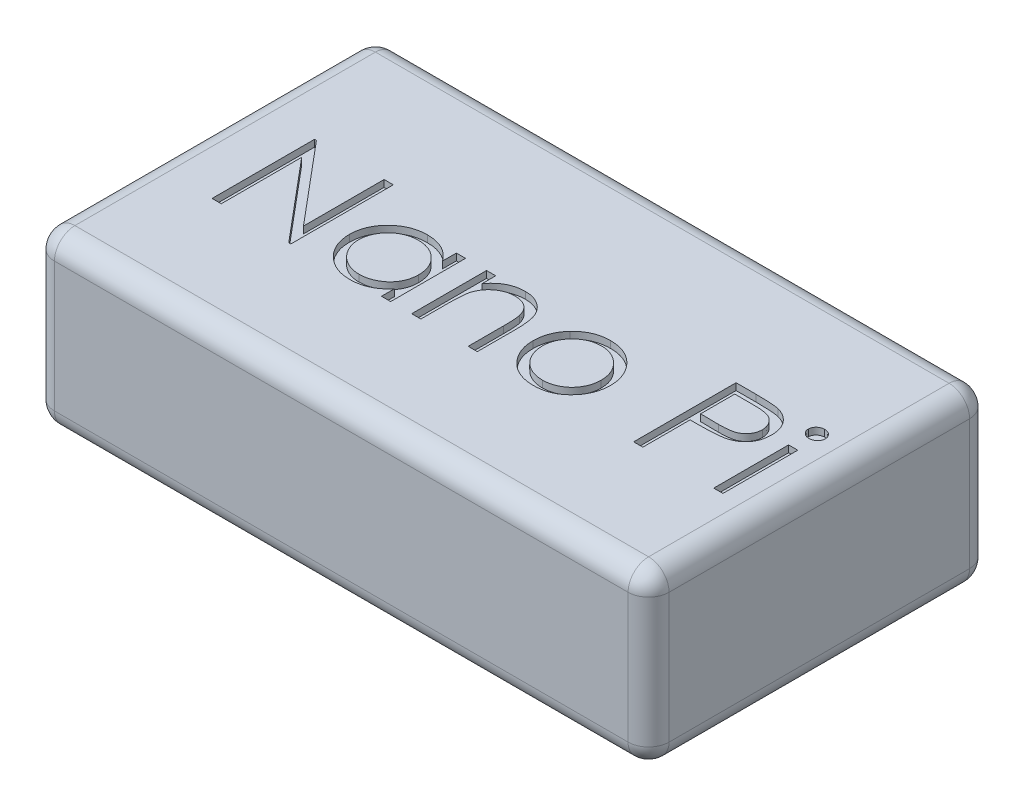
from build123d import *

# Parameters (mm, degrees)
SKETCH1_W           = 90
SKETCH1_H           = 50
BOSS_EXTRUDE1_DEPTH = 25
FILLET1_R           = 3
SKETCH2_W           = 1.346153846
SKETCH2_H           = 10.961538462
CUT_EXTRUDE1_DEPTH  = 1


with BuildPart() as part:
    # Sketch1 → Boss-Extrude1 (new body)
    with BuildSketch(Plane(origin=(0, 0, 0), x_dir=(1, 0, 0), z_dir=(0, 1, 0))):
        with Locations((-3.591549296, -0.528169014)):
            Rectangle(SKETCH1_W, SKETCH1_H)
    extrude(amount=BOSS_EXTRUDE1_DEPTH)

    # Fillet1
    fillet1_edges = [part.edges().sort_by_distance(p)[0] for p in [
        (41.408450704, 25, 0.528169014),
        (-3.591549296, 25, -24.471830986),
        (-48.591549296, 25, 0.528169014),
        (-3.591549296, 0, -24.471830986),
        (41.408450704, 0, 0.528169014),
        (-3.591549296, 0, 25.528169014),
        (-48.591549296, 0, 0.528169014),
        (-3.591549296, 25, 25.528169014),
        (-48.591549296, 12.5, -24.471830986),
        (41.408450704, 12.5, -24.471830986),
        (41.408450704, 12.5, 25.528169014),
        (-48.591549296, 12.5, 25.528169014),
    ]]
    fillet(fillet1_edges, radius=FILLET1_R)

    # Sketch2 → Cut-Extrude1 (cut)
    # profile 1 of 7: a face of its own
    with BuildSketch(Plane(origin=(0, 25, 0), x_dir=(1, 0, 0), z_dir=(0, 1, 0))):
        Polygon((-38.992409877, -9.047322297), (-38.992409877, 5.952677703), (-38.709957954, 5.952677703), (-28.800102185, -5.85321172), (-28.800102185, 5.952677703), (-27.453948339, 5.952677703), (-27.453948339, -9.047322297), (-27.760438724, -9.047322297), (-37.646256031, 2.731523857), (-37.646256031, -9.047322297), align=None)
    # profile 2 of 7: a face of its own
    with BuildSketch(Plane(origin=(0, 25, 0), x_dir=(1, 0, 0), z_dir=(0, 1, 0))):
        with BuildLine():
            Line((-12.838563724, 1.914216165), (-12.838563724, -9.047322297))
            Line((-12.838563724, -9.047322297), (-14.18471757, -9.047322297))
            Line((-14.18471757, -9.047322297), (-14.18471757, -7.151288643))
            add(Edge.make_bspline(
                [(-14.18471757, -7.151288643), (-14.336512387, -7.322886903), (-14.632741881, -7.657763064), (-15.127489529, -8.095258089), (-15.651924577, -8.456879467), (-16.203501668, -8.748950535), (-16.781722711, -8.968345062), (-17.385305942, -9.124285744), (-18.014497574, -9.224545037), (-18.444150523, -9.23455656), (-18.661881031, -9.239629989)],
                knots=[0, 0, 0, 0, 1.074387032, 2.096679803, 3.090159297, 4.057316773, 5.018401886, 5.985159533, 6.978961417, 8, 8, 8, 8], degree=3))
            add(Edge.make_bspline(
                [(-18.661881031, -9.239629989), (-18.855457976, -9.234374108), (-19.237200283, -9.224009277), (-19.798753471, -9.143599405), (-20.339148826, -9.014468169), (-20.858896994, -8.834892928), (-21.35463476, -8.596689407), (-21.830606603, -8.31151263), (-22.284346712, -7.971909072), (-22.708939022, -7.583674665), (-23.099933309, -7.161981863), (-23.443053049, -6.712215233), (-23.729137677, -6.236319645), (-23.968366594, -5.740320414), (-24.152636642, -5.220399331), (-24.281095074, -4.678354325), (-24.361411274, -4.114826296), (-24.37177182, -3.731085482), (-24.377025262, -3.536504989)],
                knots=[0, 0, 0, 0, 1.033919861, 2.038935746, 3.024066025, 3.998881131, 4.97069526, 5.957263378, 6.95902576, 7.993208707, 9.027059324, 10.027763471, 11.009749337, 11.988697705, 12.965288445, 13.950418724, 14.960734635, 16, 16, 16, 16], degree=3))
            add(Edge.make_bspline(
                [(-24.377025262, -3.536504989), (-24.371655385, -3.345946259), (-24.361039427, -2.969221931), (-24.281954199, -2.415170368), (-24.148964162, -1.881520679), (-23.962330529, -1.369990922), (-23.723007865, -0.879962136), (-23.431887492, -0.411087743), (-23.088948386, 0.03792396), (-22.693580927, 0.456514932), (-22.265289055, 0.843174708), (-21.80710878, 1.179213474), (-21.330437574, 1.46942854), (-20.827881815, 1.69937201), (-20.306879937, 1.88541103), (-19.762793741, 2.01412375), (-19.197886975, 2.089969412), (-18.814356295, 2.100952687), (-18.619813724, 2.106523857)],
                knots=[0, 0, 0, 0, 1.020392517, 2.01726096, 2.990465484, 3.961182959, 4.928053699, 5.906110375, 6.912531644, 7.948652711, 8.985773172, 9.998621852, 10.987621588, 11.969261332, 12.953316658, 13.946091881, 14.958173133, 16, 16, 16, 16], degree=3))
            add(Edge.make_bspline(
                [(-18.619813724, 2.106523857), (-18.396100042, 2.100362065), (-17.957408071, 2.088279081), (-17.315716602, 1.987724535), (-16.70866884, 1.81784539), (-16.13157876, 1.586770399), (-15.586518676, 1.279704417), (-15.078648744, 0.892361727), (-14.602653815, 0.427185211), (-14.32673828, 0.069883307), (-14.18471757, -0.114029027)],
                knots=[0, 0, 0, 0, 1.038897134, 2.037228247, 3.008116434, 3.962042015, 4.918381754, 5.904844433, 6.921570401, 8, 8, 8, 8], degree=3))
            Line((-14.18471757, -0.114029027), (-14.18471757, 1.914216165))
            Line((-14.18471757, 1.914216165), (-12.838563724, 1.914216165))
        make_face()
        with BuildLine():
            add(Edge.make_bspline(
                [(-18.601784877, 0.760370011), (-18.798560611, 0.753368707), (-19.186964611, 0.739549245), (-19.757153191, 0.631662837), (-20.302782109, 0.452157433), (-20.821122427, 0.20666357), (-21.303986213, -0.102031015), (-21.735530516, -0.475408372), (-22.119284951, -0.90328129), (-22.442034654, -1.383718906), (-22.705136784, -1.898767868), (-22.89013835, -2.437158317), (-23.01214941, -2.989179649), (-23.024614498, -3.363591159), (-23.030871416, -3.551529027)],
                knots=[0, 0, 0, 0, 1.031046209, 2.035121221, 3.029706178, 4.034933723, 5.034054252, 6.02443088, 7.017295772, 8.038157696, 9.050218397, 10.03989886, 11.016116709, 12, 12, 12, 12], degree=3))
            add(Edge.make_bspline(
                [(-23.030871416, -3.551529027), (-23.022879016, -3.738343772), (-23.006925544, -4.111241012), (-22.892279711, -4.664014912), (-22.699937396, -5.202532235), (-22.437471413, -5.722222208), (-22.10881445, -6.204725495), (-21.727863082, -6.640754592), (-21.290933305, -7.01570997), (-20.806958274, -7.329585285), (-20.290066972, -7.583138946), (-19.74649298, -7.759563116), (-19.186454531, -7.87346789), (-18.805658815, -7.886772791), (-18.613804108, -7.893476143)],
                knots=[0, 0, 0, 0, 0.979072187, 1.954306742, 2.945804271, 3.96968567, 4.997920485, 5.998718438, 6.996577872, 8.005894225, 9.015743152, 10.005417472, 10.995077863, 12, 12, 12, 12], degree=3))
            add(Edge.make_bspline(
                [(-18.613804108, -7.893476143), (-18.419033382, -7.886362012), (-18.031653726, -7.87221271), (-17.459773549, -7.763864431), (-16.904795137, -7.584855295), (-16.374278444, -7.33671618), (-15.880066453, -7.029184655), (-15.436504121, -6.669154265), (-15.061435685, -6.250426333), (-14.743467358, -5.790241534), (-14.494144144, -5.285761549), (-14.312532461, -4.748615018), (-14.205158579, -4.17878324), (-14.191625452, -3.78936641), (-14.18471757, -3.590591527)],
                knots=[0, 0, 0, 0, 1.01762866, 2.023962475, 3.030623092, 4.058876274, 5.077231937, 6.066672613, 7.034107872, 8.005628644, 8.981990164, 9.965428785, 10.961468474, 12, 12, 12, 12], degree=3))
            add(Edge.make_bspline(
                [(-14.18471757, -3.590591527), (-14.188830383, -3.439143682), (-14.1969257, -3.141046397), (-14.258770998, -2.703357036), (-14.357149254, -2.28449821), (-14.495775697, -1.884029542), (-14.677881202, -1.504165191), (-14.897514484, -1.142177647), (-15.15853784, -0.799949598), (-15.456749395, -0.48219358), (-15.783171692, -0.192365884), (-16.128576866, 0.066338005), (-16.49705721, 0.278861316), (-16.88241594, 0.45475248), (-17.285321659, 0.594720265), (-17.709052886, 0.688096096), (-18.149105688, 0.752211757), (-18.449303068, 0.75762196), (-18.601784877, 0.760370011)],
                knots=[0, 0, 0, 0, 1.050140795, 2.067009409, 3.05949893, 4.030605086, 5.00011959, 5.97591094, 6.962425594, 7.979863591, 8.993523472, 9.986985069, 10.967611495, 11.937549037, 12.921786183, 13.919465291, 14.943216303, 16, 16, 16, 16], degree=3))
        make_face(mode=Mode.SUBTRACT)
    # profile 3 of 7: a face of its own
    with BuildSketch(Plane(origin=(0, 25, 0), x_dir=(1, 0, 0), z_dir=(0, 1, 0))):
        with BuildLine():
            Line((-9.761640647, 1.914216165), (-8.415486801, 1.914216165))
            Line((-8.415486801, 1.914216165), (-8.415486801, -0.062947297))
            add(Edge.make_bspline(
                [(-8.415486801, -0.062947297), (-8.271754079, 0.116378658), (-7.992835717, 0.464366931), (-7.528331431, 0.921740821), (-7.037429001, 1.298648929), (-6.523134701, 1.59909376), (-5.984750372, 1.825579301), (-5.425557786, 1.989147577), (-4.842209046, 2.087225413), (-4.445504316, 2.100040686), (-4.244813724, 2.106523857)],
                knots=[0, 0, 0, 0, 1.12780773, 2.188550248, 3.19190651, 4.159438251, 5.104880172, 6.052711206, 7.014878035, 8, 8, 8, 8], degree=3))
            add(Edge.make_bspline(
                [(-4.244813724, 2.106523857), (-4.041968149, 2.099044448), (-3.64495043, 2.084405441), (-3.066901595, 1.968619622), (-2.527015622, 1.770854242), (-2.027217526, 1.499945369), (-1.576672326, 1.163060483), (-1.180994391, 0.770584276), (-0.853723331, 0.319143919), (-0.634306061, -0.099669608), (-0.489767571, -0.471193012), (-0.398771839, -0.789393369), (-0.321496204, -1.143899731), (-0.254502998, -1.533640827), (-0.209172519, -1.961347357), (-0.173419841, -2.425266037), (-0.147796865, -2.925246597), (-0.146780264, -3.271046428), (-0.146256031, -3.449365566)],
                knots=[0, 0, 0, 0, 1.235846778, 2.418850247, 3.575807741, 4.728682307, 5.871620074, 6.994088408, 8.11269785, 9.256955736, 9.865816715, 10.540099792, 11.271859618, 12.076849838, 12.949306005, 13.892391288, 14.913166135, 16, 16, 16, 16], degree=3))
            Line((-0.146256031, -3.449365566), (-0.146256031, -9.047322297))
            Line((-0.146256031, -9.047322297), (-1.492409877, -9.047322297))
            Line((-1.492409877, -9.047322297), (-1.492409877, -3.891072297))
            add(Edge.make_bspline(
                [(-1.492409877, -3.891072297), (-1.493237912, -3.741833247), (-1.494821801, -3.456364344), (-1.499817429, -3.047639958), (-1.511859458, -2.676983194), (-1.528780799, -2.345280191), (-1.553548072, -2.052849463), (-1.57935935, -1.799095419), (-1.610923536, -1.584340238), (-1.639050306, -1.455061313), (-1.651664685, -1.397081912)],
                knots=[0, 0, 0, 0, 1.430800155, 2.736877192, 3.918605307, 4.986035426, 5.920637409, 6.731861385, 7.431261377, 8, 8, 8, 8], degree=3))
            add(Edge.make_bspline(
                [(-1.651664685, -1.397081912), (-1.697202677, -1.226891119), (-1.784849223, -0.8993265), (-2.001423436, -0.455007845), (-2.274912783, -0.077015612), (-2.608760709, 0.232313195), (-2.999742461, 0.473045352), (-3.446773073, 0.640076587), (-3.945538676, 0.744546312), (-4.296343173, 0.754948306), (-4.479188724, 0.760370011)],
                knots=[0, 0, 0, 0, 1.084156227, 2.086665306, 3.027808233, 3.945421172, 4.874247719, 5.839848303, 6.874090471, 8, 8, 8, 8], degree=3))
            add(Edge.make_bspline(
                [(-4.479188724, 0.760370011), (-4.587478796, 0.758329991), (-4.801782052, 0.754292844), (-5.119567646, 0.713787281), (-5.427814102, 0.647536757), (-5.729614998, 0.558099739), (-6.018934114, 0.435261443), (-6.30506679, 0.295849856), (-6.577238637, 0.122071805), (-6.841253196, -0.071602287), (-7.086879514, -0.286227461), (-7.315429536, -0.512703933), (-7.519163909, -0.753885092), (-7.703743946, -1.005884867), (-7.86307936, -1.272164173), (-8.002164023, -1.550154058), (-8.120174144, -1.84022041), (-8.178814254, -2.041542101), (-8.20815507, -2.14227422)],
                knots=[0, 0, 0, 0, 1.023777757, 2.026029729, 3.023749952, 4.003683103, 4.997618607, 5.993177895, 7.010360494, 8.046726602, 9.087585522, 10.09234134, 11.086953743, 12.070360549, 13.043493632, 14.017870808, 15.008233677, 16, 16, 16, 16], degree=3))
            add(Edge.make_bspline(
                [(-8.20815507, -2.14227422), (-8.225039278, -2.21622509), (-8.261795316, -2.377212266), (-8.301494658, -2.641402635), (-8.337527124, -2.947016813), (-8.367685518, -3.293698172), (-8.386137303, -3.682660494), (-8.406256146, -4.112242656), (-8.413580694, -4.584157606), (-8.41483364, -4.912707718), (-8.415486801, -5.08398095)],
                knots=[0, 0, 0, 0, 0.615963638, 1.340920617, 2.168419149, 3.115676021, 4.16674242, 5.331190069, 6.6087489, 8, 8, 8, 8], degree=3))
            Line((-8.415486801, -5.08398095), (-8.415486801, -9.047322297))
            Line((-8.415486801, -9.047322297), (-9.761640647, -9.047322297))
            Line((-9.761640647, -9.047322297), (-9.761640647, 1.914216165))
        make_face()
    # profile 4 of 7: a face of its own
    with BuildSketch(Plane(origin=(0, 25, 0), x_dir=(1, 0, 0), z_dir=(0, 1, 0))):
        with BuildLine():
            add(Edge.make_bspline(
                [(8.225138199, 2.106523857), (8.430815083, 2.102144324), (8.834097187, 2.093557129), (9.424702412, 2.001778705), (9.98846728, 1.861432857), (10.527550961, 1.667411877), (11.03504937, 1.407346375), (11.518354702, 1.097020841), (11.976141883, 0.729381155), (12.250526294, 0.444989433), (12.389801661, 0.300634434)],
                knots=[0, 0, 0, 0, 1.054011418, 2.066658804, 3.057071809, 4.030435133, 4.997543892, 5.974964718, 6.972108034, 8, 8, 8, 8], degree=3))
            add(Edge.make_bspline(
                [(12.389801661, 0.300634434), (12.509724321, 0.162574495), (12.747248808, -0.110873543), (13.051816174, -0.554254741), (13.314194289, -1.013426601), (13.524464122, -1.494486573), (13.690257081, -1.993235163), (13.807967207, -2.51138664), (13.877982643, -3.047796699), (13.88742393, -3.412098862), (13.892205507, -3.596601143)],
                knots=[0, 0, 0, 0, 1.025258237, 2.030674902, 3.01204498, 3.988269485, 4.97094183, 5.956517959, 6.965070386, 8, 8, 8, 8], degree=3))
            add(Edge.make_bspline(
                [(13.892205507, -3.596601143), (13.887999776, -3.782172819), (13.879689054, -4.148871104), (13.801073556, -4.6889541), (13.678797473, -5.212646198), (13.503803881, -5.717754885), (13.279411984, -6.205824145), (13.005594752, -6.674722214), (12.680430678, -7.125374214), (12.311842121, -7.55395352), (11.904476937, -7.948951584), (11.462550588, -8.293215596), (10.994747586, -8.588164986), (10.4948475, -8.825749625), (9.967415414, -9.013076912), (9.411313693, -9.144648411), (8.827406249, -9.224198484), (8.428718158, -9.234413798), (8.225138199, -9.239629989)],
                knots=[0, 0, 0, 0, 0.998656419, 1.973391657, 2.932242238, 3.890759089, 4.846373663, 5.82037756, 6.809684879, 7.83454468, 8.860553229, 9.859544525, 10.845671541, 11.83227036, 12.833544569, 13.85385346, 14.904124723, 16, 16, 16, 16], degree=3))
            add(Edge.make_bspline(
                [(8.225138199, -9.239629989), (8.02056083, -9.234396291), (7.619885717, -9.224145829), (7.033917223, -9.144957474), (6.476818856, -9.013137549), (5.948696291, -8.825134009), (5.446646947, -8.588157393), (4.976133389, -8.294107294), (4.533848036, -7.948849486), (4.126396675, -7.553981185), (3.757831223, -7.125367086), (3.432661188, -6.674724064), (3.158845504, -6.205823663), (2.934453202, -5.717755014), (2.759459718, -5.212646163), (2.637183606, -4.68895411), (2.558568115, -4.148871102), (2.550257393, -3.782172818), (2.546051661, -3.596601143)],
                knots=[0, 0, 0, 0, 1.099876186, 2.154163076, 3.173186993, 4.173200201, 5.163417411, 6.152872554, 7.150605724, 8.17532212, 9.198891216, 10.186952605, 11.159729845, 12.11414092, 13.071450619, 14.029093627, 15.002601286, 16, 16, 16, 16], degree=3))
            add(Edge.make_bspline(
                [(2.546051661, -3.596601143), (2.550865848, -3.41310166), (2.560397112, -3.049804221), (2.63034215, -2.514402533), (2.747593107, -1.997128008), (2.913584806, -1.50030454), (3.125792767, -1.021352671), (3.384484001, -0.561046253), (3.69215814, -0.119669965), (3.928737933, 0.153424664), (4.048455507, 0.291620011)],
                knots=[0, 0, 0, 0, 1.031353054, 2.041901799, 3.029428768, 4.008703097, 4.981709435, 5.96992636, 6.972712378, 8, 8, 8, 8], degree=3))
            add(Edge.make_bspline(
                [(4.048455507, 0.291620011), (4.187520897, 0.437226894), (4.461017457, 0.723588449), (4.921083433, 1.090156409), (5.403199809, 1.406939583), (5.916306635, 1.661837649), (6.454947455, 1.862574154), (7.021601351, 2.002140647), (7.614210703, 2.093226454), (8.019466222, 2.102047216), (8.225138199, 2.106523857)],
                knots=[0, 0, 0, 0, 1.027980169, 2.021703884, 2.998553061, 3.971491411, 4.943284454, 5.930300938, 6.949603206, 8, 8, 8, 8], degree=3))
        make_face()
        with BuildLine():
            add(Edge.make_bspline(
                [(8.219128584, 0.760370011), (8.073681678, 0.756236047), (7.786542556, 0.748074836), (7.363887193, 0.686000958), (6.957000819, 0.587654512), (6.565111487, 0.447922843), (6.189540748, 0.26749899), (5.829929023, 0.045891732), (5.485218566, -0.213963796), (5.16215258, -0.51166096), (4.865656957, -0.83685665), (4.606465629, -1.183349617), (4.386072316, -1.545519673), (4.202471634, -1.923743435), (4.065726543, -2.32185378), (3.966413589, -2.735342199), (3.904398273, -3.165051127), (3.896313793, -3.457169777), (3.892205507, -3.605615566)],
                knots=[0, 0, 0, 0, 1.021534396, 2.016698045, 2.994645724, 3.958388632, 4.93408049, 5.916473867, 6.921342795, 7.962252576, 8.998418191, 10.008913653, 10.997312074, 11.973003931, 12.956656626, 13.948281152, 14.957379055, 16, 16, 16, 16], degree=3))
            add(Edge.make_bspline(
                [(3.892205507, -3.605615566), (3.899091894, -3.797409968), (3.912760085, -4.178085992), (4.023911098, -4.738705089), (4.209852297, -5.276913026), (4.460940639, -5.789554681), (4.775538719, -6.263864444), (5.146197576, -6.686742234), (5.568939149, -7.051824283), (6.03872415, -7.354742192), (6.545956941, -7.59542686), (7.082769746, -7.765993898), (7.642658435, -7.87687258), (8.02529014, -7.887893185), (8.219128584, -7.893476143)],
                knots=[0, 0, 0, 0, 1.016792936, 2.018143844, 3.017858371, 4.030088057, 5.03801393, 6.028138512, 7.003788237, 7.991172063, 8.984598303, 9.972568034, 10.972917682, 12, 12, 12, 12], degree=3))
            add(Edge.make_bspline(
                [(8.219128584, -7.893476143), (8.41295588, -7.887860656), (8.795565577, -7.876775841), (9.354676334, -7.766552328), (9.890021928, -7.594679496), (10.396727875, -7.355012882), (10.866299032, -7.050673962), (11.292080981, -6.688803774), (11.659575028, -6.262744412), (11.973861907, -5.788926431), (12.229062233, -5.277707779), (12.414133097, -4.738605755), (12.525551323, -4.17811129), (12.539183446, -3.797418443), (12.546051661, -3.605615566)],
                knots=[0, 0, 0, 0, 1.02726834, 2.027799167, 3.010890988, 4.004497153, 4.992059811, 5.971914811, 6.958719428, 7.966827853, 8.981595046, 9.981490638, 10.983022906, 12, 12, 12, 12], degree=3))
            add(Edge.make_bspline(
                [(12.546051661, -3.605615566), (12.541944789, -3.45716889), (12.533863093, -3.165048494), (12.471827532, -2.735352265), (12.372589504, -2.32181685), (12.235568288, -1.923879694), (12.052765371, -1.544540389), (11.828121972, -1.184412988), (11.569989006, -0.835656362), (11.269915631, -0.512712187), (10.947186869, -0.213847744), (10.602336705, 0.045992496), (10.243258225, 0.266525048), (9.868778585, 0.449466079), (9.47683901, 0.586383252), (9.070522742, 0.686568815), (8.649670699, 0.747812515), (8.363560514, 0.756157407), (8.219128584, 0.760370011)],
                knots=[0, 0, 0, 0, 1.042956736, 2.052379634, 3.044323526, 4.02829302, 5.004299113, 5.996692471, 7.007513377, 8.048758398, 9.090003419, 10.095195979, 11.07790575, 12.047570684, 13.018257071, 13.989683339, 14.985167495, 16, 16, 16, 16], degree=3))
        make_face(mode=Mode.SUBTRACT)
    # profile 5 of 7: a face of its own
    with BuildSketch(Plane(origin=(0, 25, 0), x_dir=(1, 0, 0), z_dir=(0, 1, 0))):
        with BuildLine():
            Line((22.738359353, 5.952677703), (25.680066084, 5.952677703))
            add(Edge.make_bspline(
                [(25.680066084, 5.952677703), (25.882398539, 5.952455291), (26.270076508, 5.952029139), (26.825998176, 5.9391088), (27.330897025, 5.921851548), (27.783684372, 5.897929148), (28.185753364, 5.869658047), (28.535284648, 5.83000645), (28.835025603, 5.788605183), (29.014624673, 5.746513441), (29.09653243, 5.727317126)],
                knots=[0, 0, 0, 0, 1.415646017, 2.712440637, 3.8905458, 4.950247383, 5.884950622, 6.709939814, 7.411656543, 8, 8, 8, 8], degree=3))
            add(Edge.make_bspline(
                [(29.09653243, 5.727317126), (29.200219004, 5.698937341), (29.405148906, 5.642846506), (29.700439091, 5.530501976), (29.981384143, 5.397292697), (30.248947965, 5.245475812), (30.499842606, 5.06853768), (30.737811353, 4.873650747), (30.960754126, 4.656315453), (31.167417234, 4.418969425), (31.357209224, 4.165597097), (31.52062215, 3.892416111), (31.657453123, 3.604024811), (31.774810001, 3.300623792), (31.859274805, 2.979665263), (31.922904376, 2.643379352), (31.963291351, 2.291802109), (31.967159473, 2.051545534), (31.969128584, 1.929240203)],
                knots=[0, 0, 0, 0, 0.999701418, 1.975846123, 2.934577507, 3.890451536, 4.834027766, 5.787354733, 6.749476667, 7.726910423, 8.712836071, 9.690891519, 10.682875813, 11.679750201, 12.712814741, 13.765529915, 14.8625177, 16, 16, 16, 16], degree=3))
            add(Edge.make_bspline(
                [(31.969128584, 1.929240203), (31.967322478, 1.805906874), (31.96378871, 1.564596886), (31.921376058, 1.211570651), (31.864246666, 0.874206122), (31.776402156, 0.553251334), (31.661349271, 0.250612318), (31.52638333, -0.03833582), (31.363596772, -0.308677271), (31.176547501, -0.561393489), (30.96846924, -0.796721684), (30.740242362, -1.012956518), (30.492788251, -1.208832254), (30.226893331, -1.384788012), (29.939965407, -1.536743496), (29.636356178, -1.672846231), (29.313426679, -1.787150777), (29.089958762, -1.847279612), (28.976340123, -1.877851143)],
                knots=[0, 0, 0, 0, 1.121902311, 2.195077645, 3.232258892, 4.234102512, 5.217864754, 6.176164875, 7.132989551, 8.084763148, 9.034132444, 9.988522005, 10.94243251, 11.903244335, 12.886203696, 13.894208494, 14.929344452, 16, 16, 16, 16], degree=3))
            add(Edge.make_bspline(
                [(28.976340123, -1.877851143), (28.882365834, -1.897835347), (28.676415717, -1.941631894), (28.337232622, -1.99052528), (27.942323825, -2.032257855), (27.49222834, -2.063548444), (26.987350176, -2.090335738), (26.427416216, -2.111627569), (25.811327313, -2.123326942), (25.38159341, -2.12393034), (25.157229546, -2.124245374)],
                knots=[0, 0, 0, 0, 0.601384939, 1.31797006, 2.144135048, 3.087295005, 4.142315834, 5.309527816, 6.595305764, 8, 8, 8, 8], degree=3))
            Line((25.157229546, -2.124245374), (24.084513199, -2.124245374))
            Line((24.084513199, -2.124245374), (24.084513199, -9.047322297))
            Line((24.084513199, -9.047322297), (22.738359353, -9.047322297))
            Line((22.738359353, -9.047322297), (22.738359353, 5.952677703))
        make_face()
        with BuildLine():
            Line((24.084513199, 4.414216165), (24.084513199, -0.585783835))
            Line((24.084513199, -0.585783835), (26.710715123, -0.61883672))
            add(Edge.make_bspline(
                [(26.710715123, -0.61883672), (26.838943376, -0.618902992), (27.086485376, -0.61903093), (27.44406919, -0.601951401), (27.775823278, -0.582234832), (28.080728601, -0.553366589), (28.358922606, -0.5125612), (28.610869158, -0.471368037), (28.834614656, -0.411773626), (29.096468378, -0.331531901), (29.388254153, -0.194677834), (29.705686504, 0.003964552), (29.974703303, 0.257167587), (30.207496003, 0.541858293), (30.39223548, 0.858568848), (30.527475447, 1.197435719), (30.60693755, 1.554983646), (30.617592666, 1.799647098), (30.622974738, 1.923230588)],
                knots=[0, 0, 0, 0, 1.160613943, 2.240541288, 3.23993089, 4.169200891, 5.011653406, 5.7853311, 6.478053781, 7.106038997, 8.262395093, 9.384106736, 10.481365981, 11.59014053, 12.70357646, 13.786202915, 14.881775077, 16, 16, 16, 16], degree=3))
            add(Edge.make_bspline(
                [(30.622974738, 1.923230588), (30.617563396, 2.043824217), (30.606806317, 2.283549426), (30.526852618, 2.634886972), (30.392498416, 2.970182848), (30.206255868, 3.282924642), (29.980222454, 3.566590945), (29.717510983, 3.813007204), (29.418739863, 4.011100215), (29.140818873, 4.138957137), (28.893956647, 4.217022603), (28.679533962, 4.271643348), (28.437431072, 4.315253089), (28.167569159, 4.350565244), (27.872039871, 4.380794363), (27.548304236, 4.401305694), (27.197588622, 4.413311935), (26.954114747, 4.413907458), (26.827902623, 4.414216165)],
                knots=[0, 0, 0, 0, 1.120700087, 2.227813068, 3.331159281, 4.466773991, 5.599788987, 6.693661531, 7.80175334, 8.91857717, 9.525282508, 10.207424825, 10.974604443, 11.810962634, 12.737642355, 13.736264703, 14.826523623, 16, 16, 16, 16], degree=3))
            Line((26.827902623, 4.414216165), (24.084513199, 4.414216165))
        make_face(mode=Mode.SUBTRACT)
    # profile 6 of 7: a face of its own
    with BuildSketch(Plane(origin=(0, 25, 0), x_dir=(1, 0, 0), z_dir=(0, 1, 0))):
        with BuildLine():
            add(Edge.make_bspline(
                [(35.136195892, 6.52960078), (35.219730102, 6.525725841), (35.38330613, 6.518137967), (35.619848706, 6.453160208), (35.835235901, 6.343018699), (36.026283327, 6.195248638), (36.190219984, 6.021465309), (36.304994457, 5.818918302), (36.378761869, 5.600095564), (36.387669963, 5.447459468), (36.392205507, 5.369745011)],
                knots=[0, 0, 0, 0, 1.055194115, 2.066272739, 3.074728998, 4.095836921, 5.109056067, 6.073838105, 7.019297344, 8, 8, 8, 8], degree=3))
            add(Edge.make_bspline(
                [(36.392205507, 5.369745011), (36.387567679, 5.294047926), (36.378399243, 5.144403747), (36.305051436, 4.929374582), (36.189241845, 4.729641938), (36.02638845, 4.556196037), (35.835208045, 4.408507666), (35.619856106, 4.298344499), (35.383304184, 4.233372482), (35.219729444, 4.225783816), (35.136195892, 4.221908473)],
                knots=[0, 0, 0, 0, 0.96129708, 1.900370562, 2.859976407, 3.87933698, 4.906634145, 5.921202961, 6.938410037, 8, 8, 8, 8], degree=3))
            add(Edge.make_bspline(
                [(35.136195892, 4.221908473), (35.05361757, 4.225635845), (34.892889655, 4.232890688), (34.659888902, 4.299619336), (34.446338233, 4.408545363), (34.254918207, 4.555229014), (34.095360237, 4.730707145), (33.979224556, 4.92925269), (33.906046148, 5.144434781), (33.896854883, 5.294058351), (33.892205507, 5.369745011)],
                knots=[0, 0, 0, 0, 1.054934014, 2.053291228, 3.073705704, 4.106921865, 5.123545215, 6.088680038, 7.033164197, 8, 8, 8, 8], degree=3))
            add(Edge.make_bspline(
                [(33.892205507, 5.369745011), (33.896753021, 5.447448652), (33.905684626, 5.600063506), (33.979279409, 5.819042219), (34.094392871, 6.020391512), (34.255023858, 6.196215081), (34.446310116, 6.34298123), (34.659896167, 6.451885437), (34.892887735, 6.518619748), (35.053616918, 6.52587381), (35.136195892, 6.52960078)],
                knots=[0, 0, 0, 0, 0.98631895, 1.937192651, 2.907499808, 3.917963147, 4.944918757, 5.95915025, 6.951458133, 8, 8, 8, 8], degree=3))
        make_face()
    # profile 7 of 7: a face of its own
    with BuildSketch(Plane(origin=(0, 25, 0), x_dir=(1, 0, 0), z_dir=(0, 1, 0))):
        with Locations((35.142205507, -3.566553066)):
            Rectangle(SKETCH2_W, SKETCH2_H)
    extrude(amount=-CUT_EXTRUDE1_DEPTH, mode=Mode.SUBTRACT)


solid = part.part
